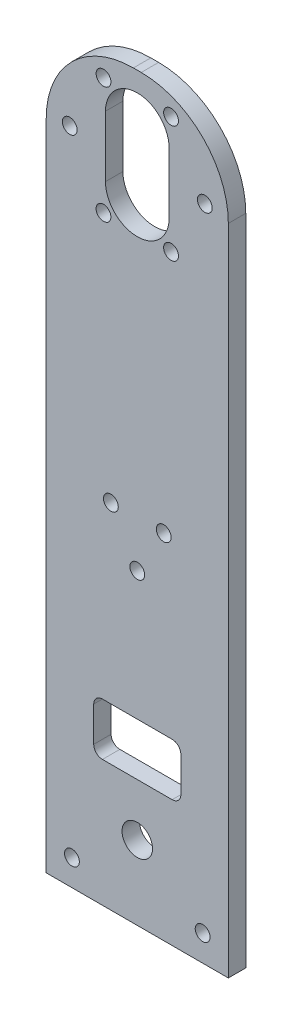
from build123d import *

# Parameters (mm, degrees)
SKETCH1_W           = 41.8
SKETCH1_H           = 170
SKETCH1_R           = 1.7
SKETCH1_R_2         = 3.5
BOSS_EXTRUDE1_DEPTH = 4
FILLET1_R           = 20
SKETCH2_R           = 1.7
DEPENDANT_DEPTH     = 10
CHAMFER1_SIZE       = 1


with BuildPart() as part:
    # Sketch1 → Boss-Extrude1 (new body)
    with BuildSketch(Plane.XY):
        with Locations((-1, -65.2)):
            Rectangle(SKETCH1_W, SKETCH1_H)
        with Locations((6.748548523, -12.425907791)):
            Circle(SKETCH1_R, mode=Mode.SUBTRACT)
        with Locations((-8.754354431, -12.425907791)):
            Circle(SKETCH1_R, mode=Mode.SUBTRACT)
        with Locations((-16.505805908, 1)):
            Circle(SKETCH1_R, mode=Mode.SUBTRACT)
        with Locations((-8.754354431, 14.425907791)):
            Circle(SKETCH1_R, mode=Mode.SUBTRACT)
        with Locations((6.748548523, 14.425907791)):
            Circle(SKETCH1_R, mode=Mode.SUBTRACT)
        with Locations((14.5, 1)):
            Circle(SKETCH1_R, mode=Mode.SUBTRACT)
        with Locations((14, -144.2)):
            Circle(SKETCH1_R, mode=Mode.SUBTRACT)
        with Locations((-16, -144.2)):
            Circle(SKETCH1_R, mode=Mode.SUBTRACT)
        with Locations((-1, -133.2)):
            Circle(SKETCH1_R_2, mode=Mode.SUBTRACT)
        with BuildLine():
            Line((6.3, 8), (6.3, -6))
            ThreePointArc((6.3, -6), (-1, -13.3), (-8.3, -6))
            Line((-8.3, -6), (-8.3, 8))
            ThreePointArc((-8.3, 8), (-1, 15.3), (6.3, 8))
        make_face(mode=Mode.SUBTRACT)
        with BuildLine():
            Line((-9, -121.2), (7, -121.2))
            ThreePointArc((7, -121.2), (8.414213562, -120.614213562), (9, -119.2))
            Line((9, -119.2), (9, -111.2))
            ThreePointArc((9, -111.2), (8.414213562, -109.785786438), (7, -109.2))
            Line((7, -109.2), (-9, -109.2))
            ThreePointArc((-9, -109.2), (-10.414213562, -109.785786438), (-11, -111.2))
            Line((-11, -111.2), (-11, -119.2))
            ThreePointArc((-11, -119.2), (-10.414213562, -120.614213562), (-9, -121.2))
        make_face(mode=Mode.SUBTRACT)
    extrude(amount=BOSS_EXTRUDE1_DEPTH)

    # Fillet1
    fillet1_edges = [part.edges().sort_by_distance(p)[0] for p in [
        (-21.9, 19.8, 2),
        (19.9, 19.8, 2),
    ]]
    fillet(fillet1_edges, radius=FILLET1_R)

    # Sketch2 → dependant (cut)
    with BuildSketch(Plane.XY.offset(4)):
        with Locations((-1, -79.702564777)):
            Circle(SKETCH2_R)
        with Locations((5.062177826, -69.202564777)):
            Circle(SKETCH2_R)
        with Locations((-7.062177826, -69.202564777)):
            Circle(SKETCH2_R)
    extrude(amount=-DEPENDANT_DEPTH, mode=Mode.SUBTRACT)

    # Chamfer1
    chamfer1_edges = [part.edges().sort_by_distance(p)[0] for p in [
        (5.048548523, -12.425907791, 0),
        (-10.454354431, -12.425907791, 0),
        (-18.205805908, 1, 0),
        (-10.454354431, 14.425907791, 0),
        (5.048548523, 14.425907791, 0),
        (12.8, 1, 0),
        (12.3, -144.2, 0),
        (-17.7, -144.2, 0),
    ]]
    chamfer(chamfer1_edges, length=CHAMFER1_SIZE)


solid = part.part
